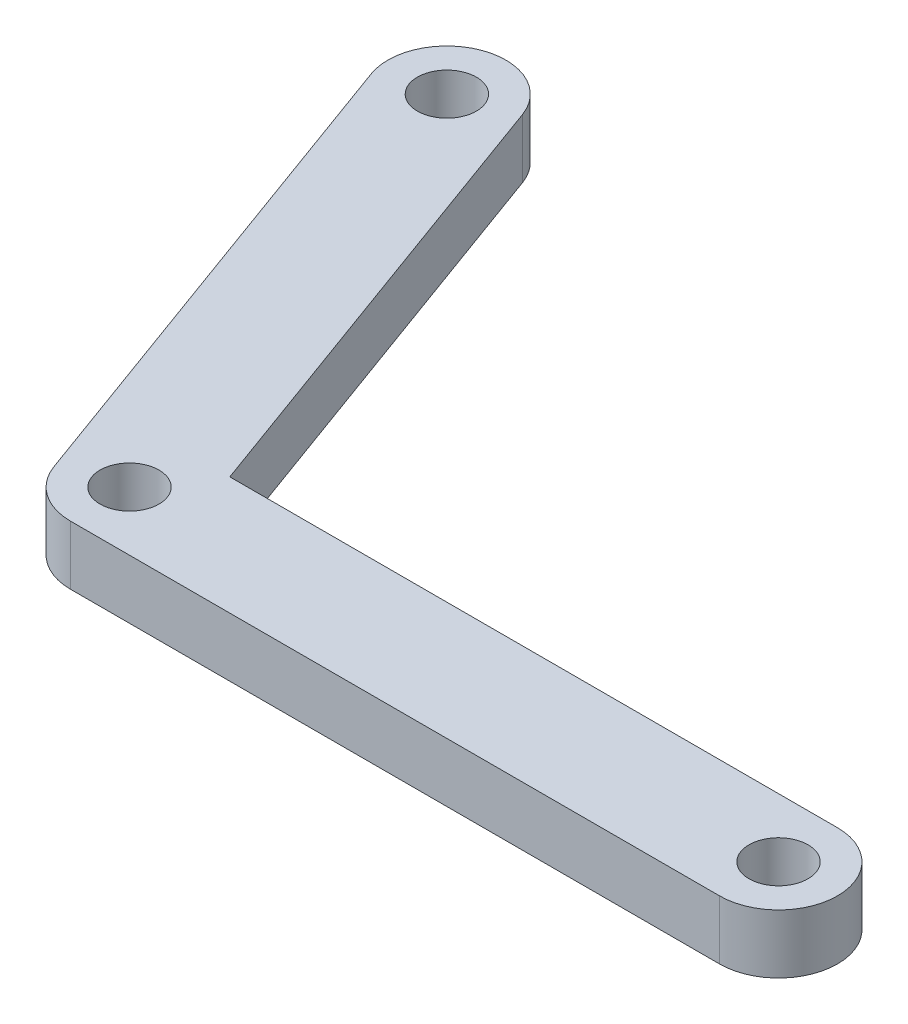
from build123d import *

# Parameters (mm, degrees)
BOSS_EXTRU_1_DEPTH      = 5
ESQUISSE3_R             = 2.5
ENL_V_MAT_EXTRU_1_DEPTH = 5
ESQUISSE4_R             = 2.5
ENL_V_MAT_EXTRU_2_DEPTH = 5


with BuildPart() as part:
    # Esquisse2 → Boss.-Extru.1 (new body)
    with BuildSketch(Plane(origin=(0, 0, 0), x_dir=(1, 0, 0), z_dir=(0, 1, 0))):
        with BuildLine():
            ThreePointArc((-4.698463104, -1.710100717), (-4.095760221, 2.867882182), (0, 5))
            Line((0, 5), (3.501037691, 5))
            Line((3.501037691, 5), (-10.692443346, 43.996268652))
            ThreePointArc((-10.692443346, 43.996268652), (-17.101007166, 46.984631039), (-20.089369554, 40.576067219))
            Line((-20.089369554, 40.576067219), (-4.698463104, -1.710100717))
        make_face()
        with BuildLine():
            Line((55, 5), (3.501037691, 5))
            Line((3.501037691, 5), (4.698463104, 1.710100717))
            ThreePointArc((4.698463104, 1.710100717), (4.095760221, -2.867882182), (0, -5))
            Line((0, -5), (55, -5))
            ThreePointArc((55, -5), (60, 0), (55, 5))
        make_face()
        with BuildLine():
            Line((3.501037691, 5), (0, 5))
            ThreePointArc((0, 5), (-4.095760221, 2.867882182), (-4.698463104, -1.710100717))
            ThreePointArc((-4.698463104, -1.710100717), (-2.867882182, -4.095760221), (0, -5))
            ThreePointArc((0, -5), (4.095760221, -2.867882182), (4.698463104, 1.710100717))
            Line((4.698463104, 1.710100717), (3.501037691, 5))
        make_face()
    extrude(amount=BOSS_EXTRU_1_DEPTH)

    # Esquisse3 → Enlèv. mat.-Extru.1 (cut)
    with BuildSketch(Plane(origin=(0, 5, 0), x_dir=(1, 0, 0), z_dir=(0, 1, 0))):
        with Locations(Location((-15.39090645, 42.286167935, 0), (0, 0, 270))):
            Circle(ESQUISSE3_R)
        with Locations(Location((55, 0, 0), (0, 0, 270))):
            Circle(ESQUISSE3_R)
    extrude(amount=-ENL_V_MAT_EXTRU_1_DEPTH, mode=Mode.SUBTRACT)

    # Esquisse4 → Enlèv. mat.-Extru.2 (cut)
    with BuildSketch(Plane(origin=(0, 5, 0), x_dir=(1, 0, 0), z_dir=(0, 1, 0))):
        with Locations(Location((0, 0, 0), (0, 0, 270))):
            Circle(ESQUISSE4_R)
    extrude(amount=-ENL_V_MAT_EXTRU_2_DEPTH, mode=Mode.SUBTRACT)


solid = part.part
